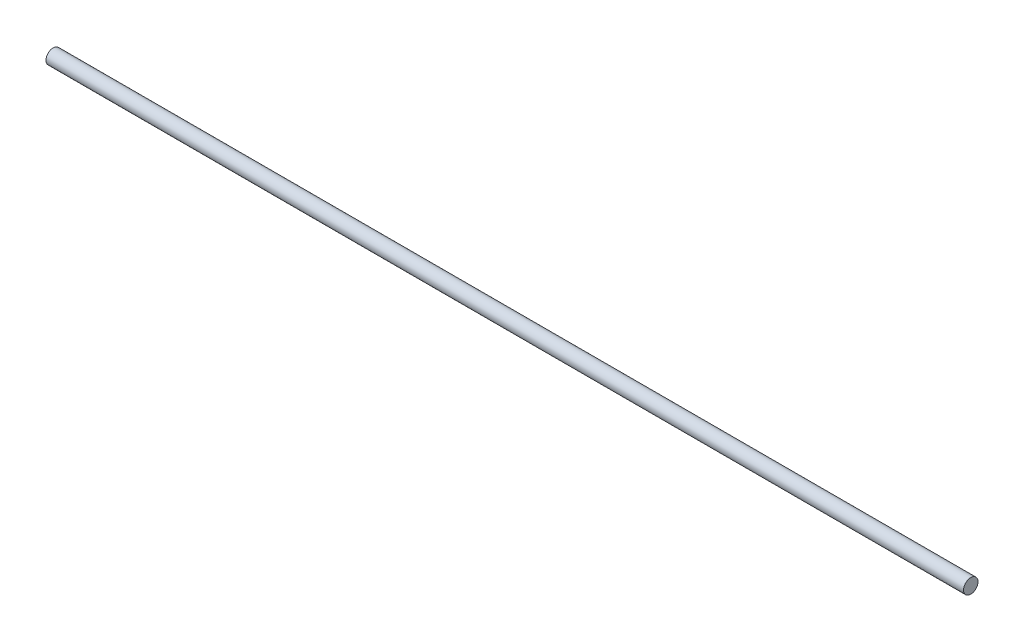
from build123d import *

# Parameters (mm, degrees)
SKETCH1_R           = 6
BOSS_EXTRUDE1_DEPTH = 381


with BuildPart() as part:
    # Sketch1 → Boss-Extrude1 (new, symmetric)
    with BuildSketch(Plane(origin=(0, 0, 0), x_dir=(0, 0, -1), z_dir=(1, 0, 0))):
        Circle(SKETCH1_R)
    extrude(amount=BOSS_EXTRUDE1_DEPTH, both=True)


solid = part.part
